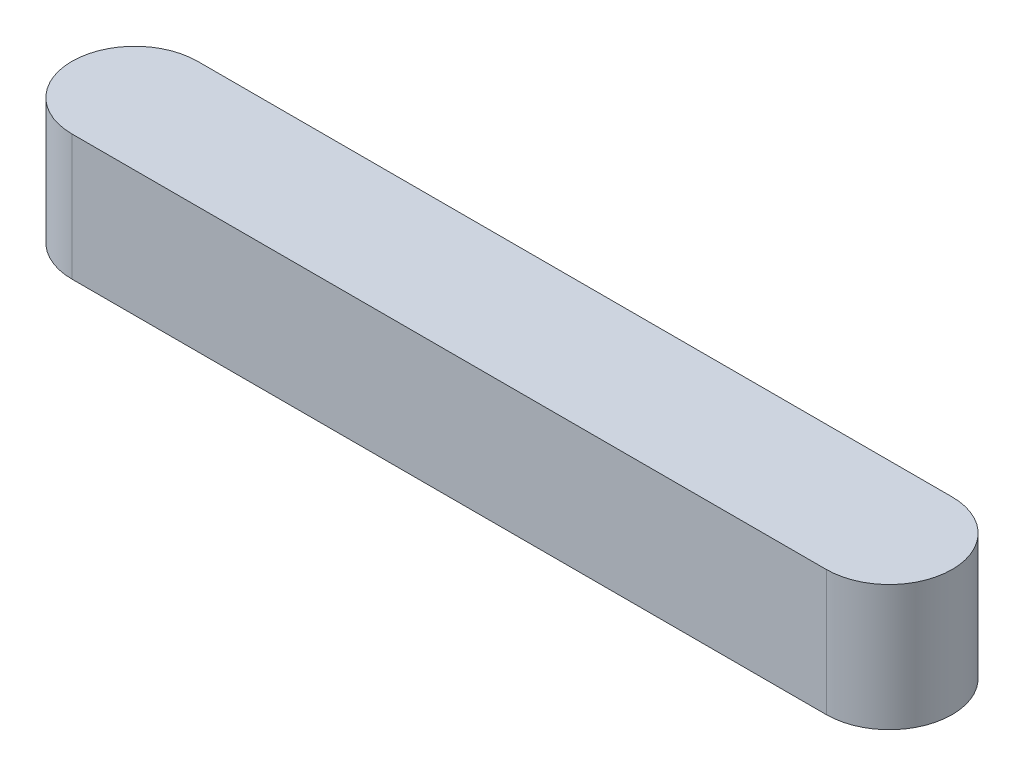
from build123d import *

# Parameters (mm, degrees)
BOSS_EXTRUDE1_DEPTH = 20


with BuildPart() as part:
    # Sketch3 → Boss-Extrude1 (new body)
    with BuildSketch(Plane(origin=(0, 0, 0), x_dir=(1, 0, 0), z_dir=(0, 1, 0))):
        with BuildLine():
            Line((-60, 10), (60, 10))
            ThreePointArc((60, 10), (70, 0), (60, -10))
            Line((60, -10), (-60, -10))
            ThreePointArc((-60, -10), (-70, 0), (-60, 10))
        make_face()
    extrude(amount=BOSS_EXTRUDE1_DEPTH)


solid = part.part
